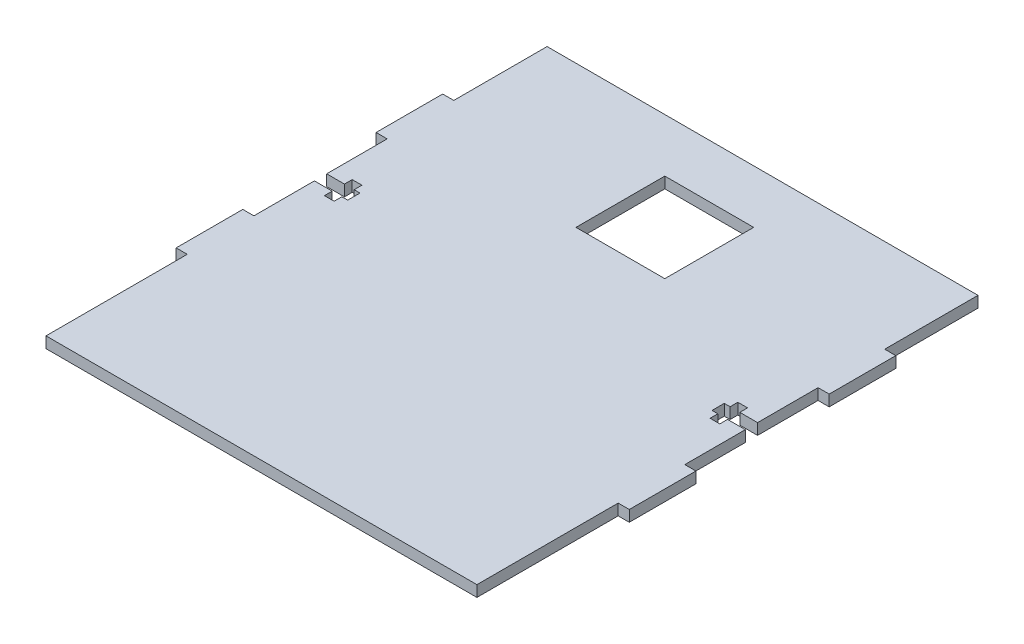
from build123d import *

# Parameters (mm, degrees)
SKETCH1_W           = 25.4
SKETCH1_H           = 25.4
BOSS_EXTRUDE1_DEPTH = 3.175


with BuildPart() as part:
    # Sketch1 → Boss-Extrude1 (new body)
    with BuildSketch(Plane(origin=(0, 0, 0), x_dir=(1, 0, 0), z_dir=(0, 1, 0))):
        Polygon((123.19, 116.586), (123.19, 143.256), (0, 143.256), (0, 116.586), (-3.175, 116.586), (-3.175, 97.536), (0, 97.536), (0, 80.2386), (5.08, 80.2386), (5.08, 82.45475), (7.858125, 82.45475), (7.858125, 80.2386), (9.525, 80.2386), (9.525, 76.7334), (7.858125, 76.7334), (7.858125, 74.51725), (5.08, 74.51725), (5.08, 76.7334), (0, 76.7334), (0, 59.436), (-3.175, 59.436), (-3.175, 40.386), (0, 40.386), (0, 0), (123.19, 0), (123.19, 40.386), (126.365, 40.386), (126.365, 59.436), (123.19, 59.436), (123.19, 76.7334), (118.11, 76.7334), (118.11, 74.51725), (115.331875, 74.51725), (115.331875, 76.7334), (113.665, 76.7334), (113.665, 80.2386), (115.331875, 80.2386), (115.331875, 82.45475), (118.11, 82.45475), (118.11, 80.2386), (123.19, 80.2386), (123.19, 97.536), (126.365, 97.536), (126.365, 116.586), align=None)
        with Locations((61.595, 115.316)):
            Rectangle(SKETCH1_W, SKETCH1_H, mode=Mode.SUBTRACT)
    extrude(amount=BOSS_EXTRUDE1_DEPTH)


solid = part.part
